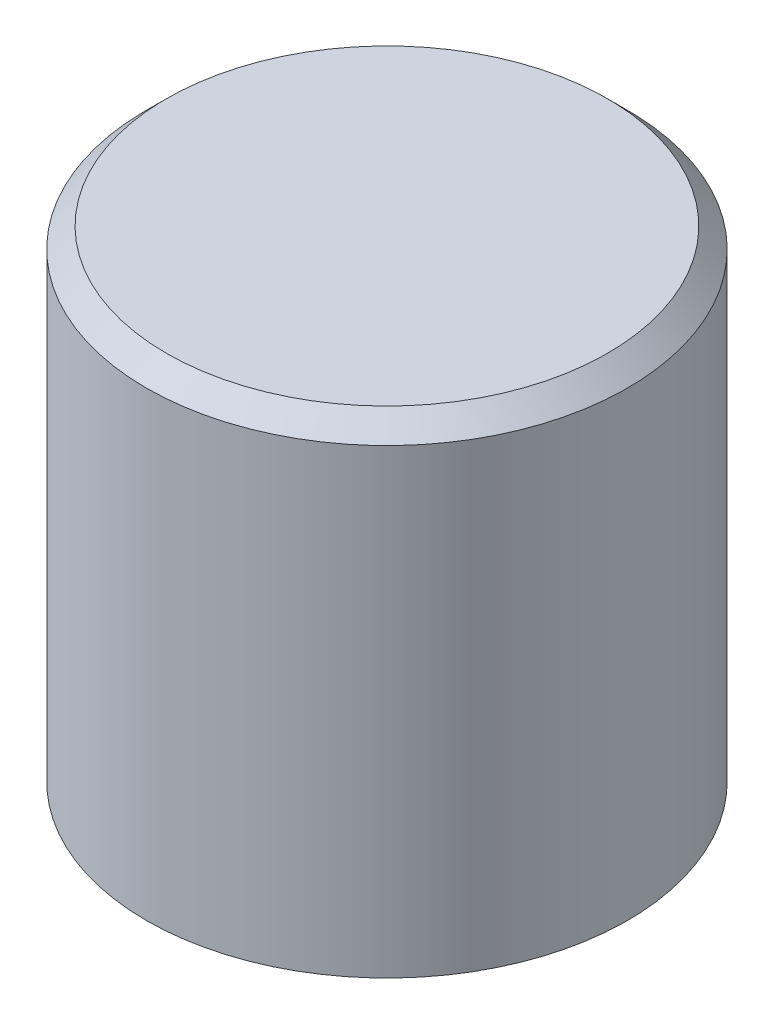
from build123d import *

# Parameters (mm, degrees)
SKETCH1_R           = 6
BOSS_EXTRUDE1_DEPTH = 12
CHAMFER1_SIZE       = 0.1
CHAMFER1_SIZE2      = 0.123280305
CHAMFER2_SIZE       = 0.5


with BuildPart() as part:
    # Sketch1 → Boss-Extrude1 (new body)
    with BuildSketch(Plane(origin=(0, 0, 0), x_dir=(1, 0, 0), z_dir=(0, 1, 0))):
        with Locations(Location((0, 0, 0), (0, 0, 270))):
            Circle(SKETCH1_R)
    extrude(amount=BOSS_EXTRUDE1_DEPTH)

    # Sketch2 → Cut-Revolve1 (revolve, cut)
    with BuildSketch(Plane.XY, mode=Mode.PRIVATE) as cut_revolve1_sk:
        Polygon((5, 0), (0, 0), (0, 8.5), (1.5, 8.5), (1.5, 4.117144432), (5, 3.5), align=None)
    revolve(cut_revolve1_sk.sketch.rotate(Axis((0, 0, 0), (0, 1, 0)), 90), axis=Axis((0, 0, 0), (0, 1, 0)), mode=Mode.SUBTRACT)

    # Chamfer1
    chamfer1_edges = [part.edges().sort_by_distance(p)[0] for p in [
        (0, 4.117144432, 1.5),
    ]]
    chamfer1_side = [part.faces().sort_by_distance(p)[0] for p in [
        (0, 3.808572216, 3.25),
    ]]
    chamfer(chamfer1_edges, length=CHAMFER1_SIZE, length2=CHAMFER1_SIZE2, reference=chamfer1_side[0])

    # Chamfer2
    chamfer2_edges = [part.edges().sort_by_distance(p)[0] for p in [
        (0, 12, -6),
    ]]
    chamfer(chamfer2_edges, length=CHAMFER2_SIZE)


solid = part.part
